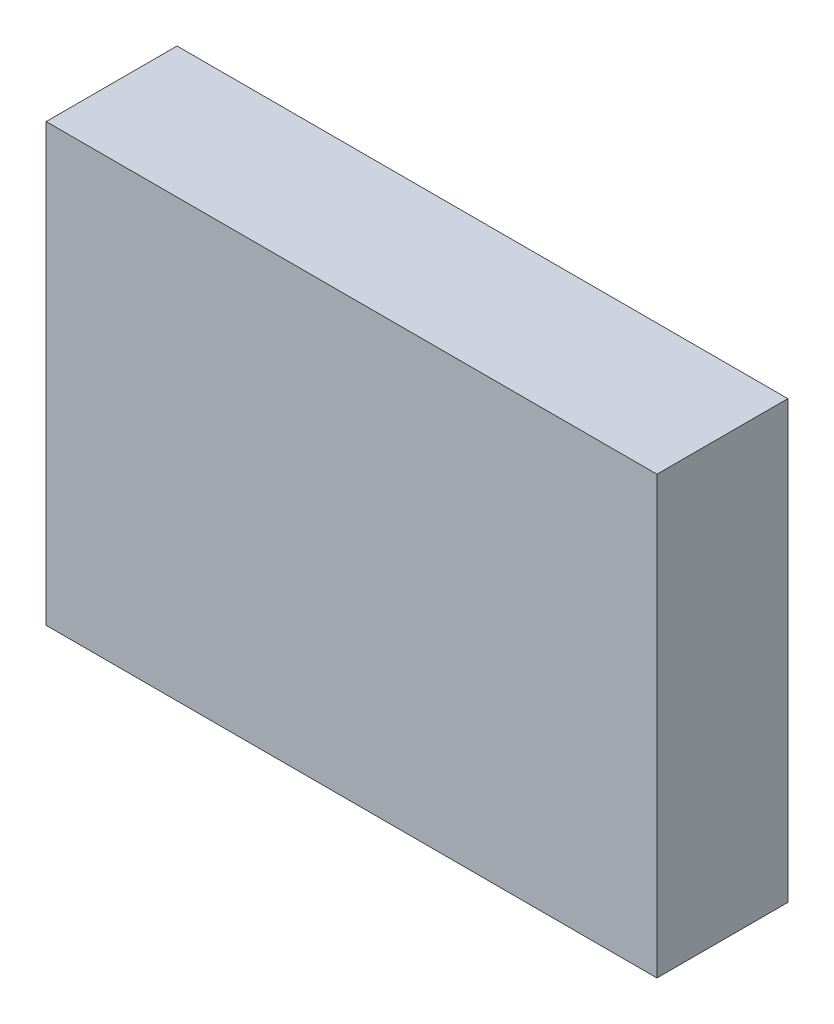
from build123d import *

# Parameters (mm, degrees)
SKETCH1_W           = 88.9
SKETCH1_H           = 63.5
BOSS_EXTRUDE1_DEPTH = 19.05


with BuildPart() as part:
    # Sketch1 → Boss-Extrude1 (new body)
    with BuildSketch(Plane.XY):
        with Locations((-4.906755584, 12.23393593)):
            Rectangle(SKETCH1_W, SKETCH1_H)
    extrude(amount=BOSS_EXTRUDE1_DEPTH)


solid = part.part
